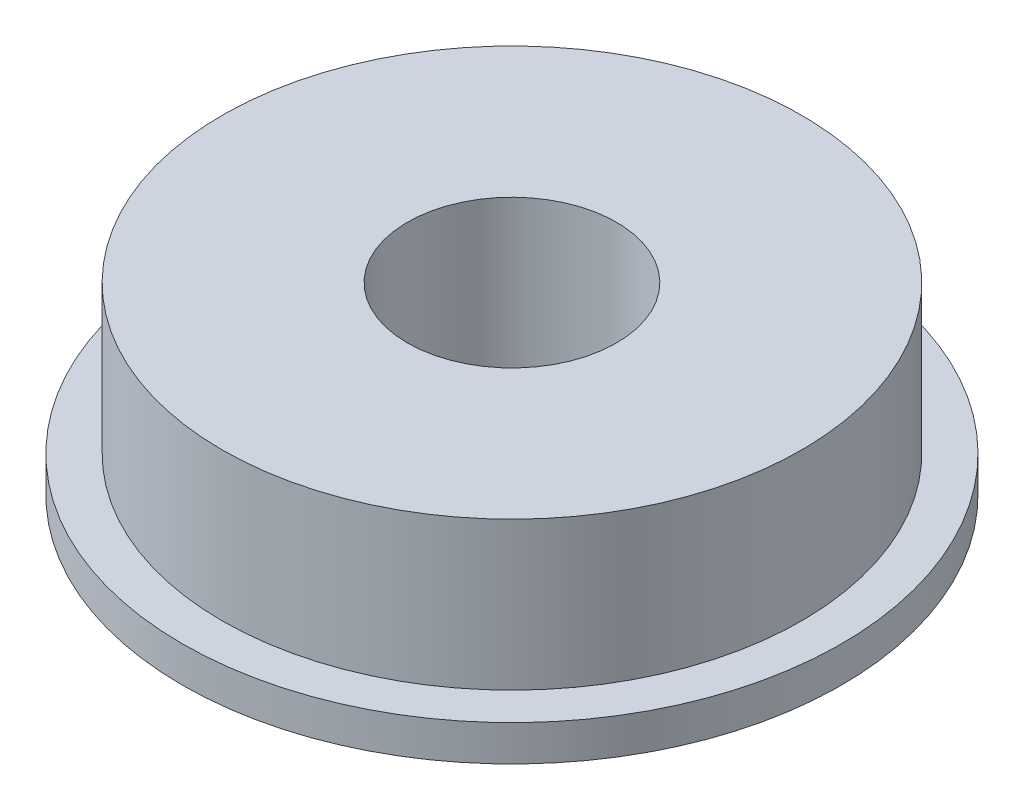
from build123d import *

# Parameters (mm, degrees)
SKETCH1_R           = 12.51
BOSS_EXTRUDE1_DEPTH = 1.36
BOSS_EXTRUDE2_START = -1.36
SKETCH2_R           = 11
BOSS_EXTRUDE2_DEPTH = 6.98
SKETCH3_R           = 3.97
CUT_EXTRUDE1_DEPTH  = 20.018953704


with BuildPart() as part:
    # Sketch1 → Boss-Extrude1 (new body)
    with BuildSketch(Plane(origin=(0, 0, 0), x_dir=(1, 0, 0), z_dir=(0, 1, 0))):
        with Locations(Location((0, 0, 0), (0, 0, 270))):
            Circle(SKETCH1_R)
    extrude(amount=BOSS_EXTRUDE1_DEPTH)

    # Sketch2 → Boss-Extrude2 (add)
    with BuildSketch(Plane(origin=(0, 1.36, 0), x_dir=(1, 0, 0), z_dir=(0, 1, 0)).offset(BOSS_EXTRUDE2_START)):
        with Locations(Location((0, 0, 0), (0, 0, 270))):
            Circle(SKETCH2_R)
    extrude(amount=BOSS_EXTRUDE2_DEPTH)

    # Sketch3 → Cut-Extrude1 (cut, through all)
    with BuildSketch(Plane(origin=(0, 6.98, 0), x_dir=(1, 0, 0), z_dir=(0, 1, 0))):
        with Locations(Location((0, 0, 0), (0, 0, 270))):
            Circle(SKETCH3_R)
    extrude(amount=-CUT_EXTRUDE1_DEPTH, mode=Mode.SUBTRACT)


solid = part.part
